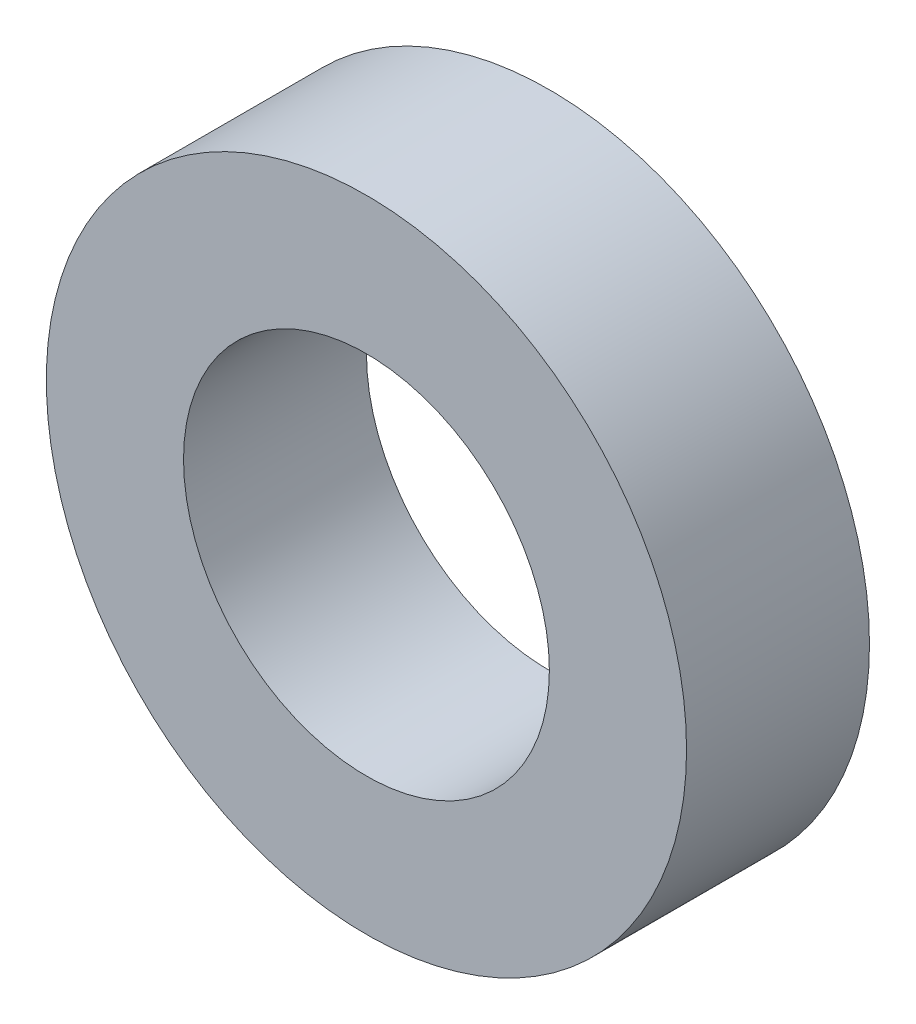
from build123d import *

# Parameters (mm, degrees)
SKETCH1_R           = 17.5
SKETCH1_R_2         = 10
BOSS_EXTRUDE1_DEPTH = 10


with BuildPart() as part:
    # Sketch1 → Boss-Extrude1 (new body)
    with BuildSketch(Plane.XY):
        with Locations((0.403421843, -40.066663422)):
            Circle(SKETCH1_R)
        with Locations((0.403421843, -40.066663422)):
            Circle(SKETCH1_R_2, mode=Mode.SUBTRACT)
    extrude(amount=BOSS_EXTRUDE1_DEPTH)


solid = part.part
